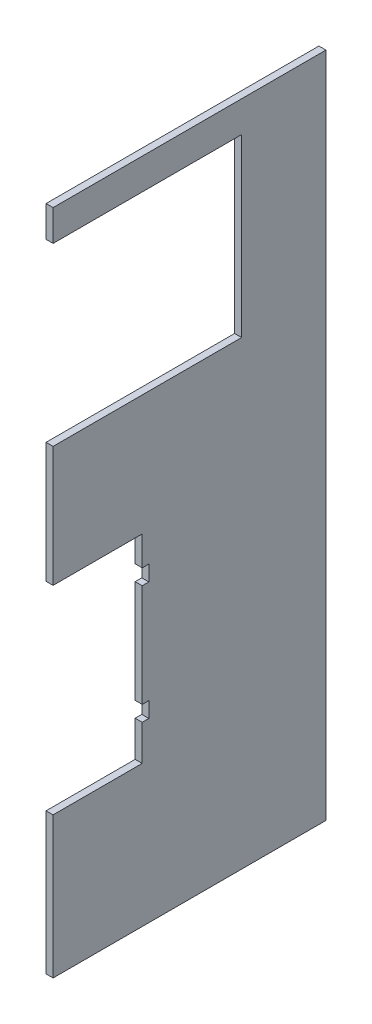
from build123d import *

# Parameters (mm, degrees)
SKETCH_1_W          = 95
SKETCH_1_H          = 38.85
EXTRUDE_1_DEPTH     = 0.5
SKETCH_2_W          = 38.85
SKETCH_2_H          = 95
EXTRUDE_2_DEPTH     = 0.5
SKETCH_3_W          = 29.202398915
SKETCH_3_H          = 25.024241253
CUT_EXTRUDE_1_DEPTH = 110.347085009


with BuildPart() as part:
    # Эскиз1 → Бобышка-Вытянуть1 (new body)
    with BuildSketch(Plane(origin=(0.5, 0, 0), x_dir=(0, -1, 0), z_dir=(-1, 0, 0))):
        with Locations((-53.35, 22.825)):
            Rectangle(SKETCH_1_W, SKETCH_1_H)
    extrude(amount=-EXTRUDE_1_DEPTH)

    # Эскиз2 → Бобышка-Вытянуть2 (add)
    with BuildSketch(Plane.ZY.offset(-0.5)):
        with Locations((22.825, 53.35)):
            Rectangle(SKETCH_2_W, SKETCH_2_H)
    extrude(amount=EXTRUDE_2_DEPTH)

    # Эскиз3 → Вырез-Вытянуть1 (cut, through all)
    with BuildSketch(Plane.ZY):
        Polygon((47.187175015, 54.261978396), (29.562288031, 54.261978396), (29.562288031, 50.078726521), (28.618889228, 50.078726521), (28.618889228, 47.878726521), (29.562288031, 47.878726521), (29.562288031, 33.238726521), (28.618889228, 33.238726521), (28.618889228, 31.038726521), (29.562288031, 31.038726521), (29.562288031, 25.969159943), (47.187175015, 25.969159943), align=None)
        with Locations((30.007497179, 83.917054381)):
            Rectangle(SKETCH_3_W, SKETCH_3_H)
    extrude(amount=-CUT_EXTRUDE_1_DEPTH, mode=Mode.SUBTRACT)


solid = part.part
